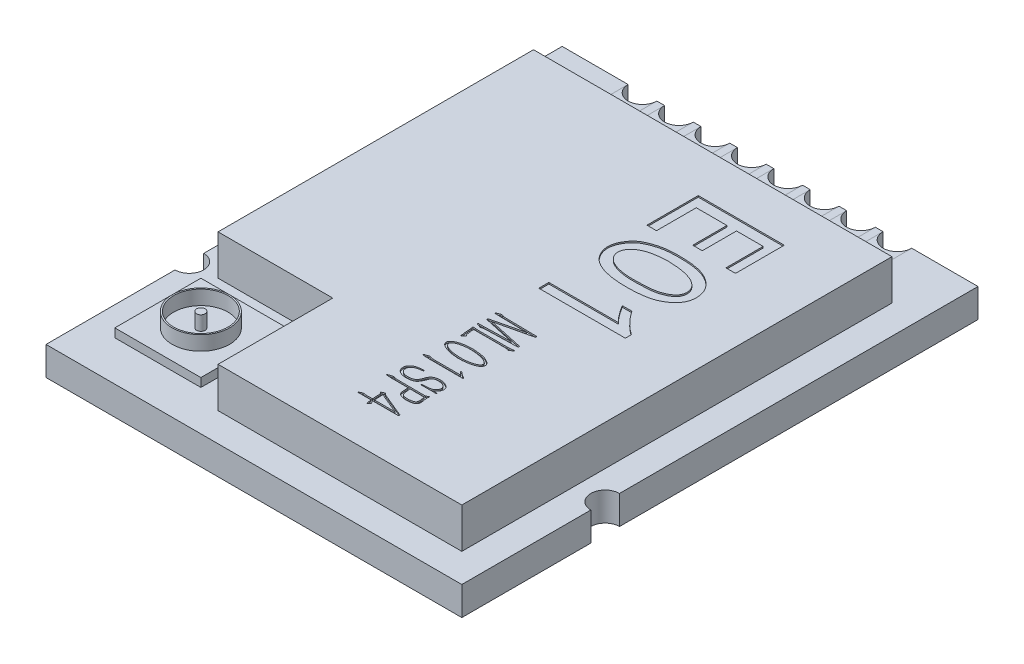
from build123d import *

# Parameters (mm, degrees)
SKETCH_1_W          = 14.5
SKETCH_1_H          = 18
EXTRUDE_1_DEPTH     = 1
EXTRUDE_2_DEPTH     = 1.4
SKETCH_3_W          = 3
SKETCH_3_H          = 3
EXTRUDE_3_DEPTH     = 0.3
SKETCH_4_R          = 1
SKETCH_4_R_2        = 0.95
SKETCH_4_R_3        = 0.15
EXTRUDE_4_DEPTH     = 0.5
CUT_EXTRUDE_2_DEPTH = 1
CUT_EXTRUDE_3_DEPTH = 0.05


with BuildPart() as part:
    # 草图1 → 凸台-拉伸1 (new body)
    with BuildSketch(Plane(origin=(0, 0, 0), x_dir=(1, 0, 0), z_dir=(0, 1, 0))):
        Rectangle(SKETCH_1_W, SKETCH_1_H)
    extrude(amount=EXTRUDE_1_DEPTH)

    # 草图2 → 凸台-拉伸2 (add)
    with BuildSketch(Plane(origin=(0, 1, 0), x_dir=(1, 0, 0), z_dir=(0, 1, 0))):
        Polygon((-6.25, 7), (6.25, 7), (6.25, -8), (-2.25, -8), (-2.25, -4), (-6.25, -4), align=None)
    extrude(amount=EXTRUDE_2_DEPTH)

    # 草图3 → 凸台-拉伸3 (add)
    with BuildSketch(Plane(origin=(0, 1, 0), x_dir=(1, 0, 0), z_dir=(0, 1, 0))):
        with Locations((-4.75, -6.1)):
            Rectangle(SKETCH_3_W, SKETCH_3_H)
    extrude(amount=EXTRUDE_3_DEPTH)

    # 草图4 → 凸台-拉伸4 (add)
    # profile 1 of 2: a face of its own
    with BuildSketch(Plane(origin=(0, 1.3, 0), x_dir=(1, 0, 0), z_dir=(0, 1, 0))):
        with Locations((-4.75, -6.1)):
            Circle(SKETCH_4_R)
        with Locations((-4.75, -6.1)):
            Circle(SKETCH_4_R_2, mode=Mode.SUBTRACT)
    # profile 2 of 2: a face of its own
    with BuildSketch(Plane(origin=(0, 1.3, 0), x_dir=(1, 0, 0), z_dir=(0, 1, 0))):
        with Locations((-4.75, -6.1)):
            Circle(SKETCH_4_R_3)
    extrude(amount=EXTRUDE_4_DEPTH)

    # 草图5 → 切除-拉伸2 (cut)
    with BuildSketch(Plane(origin=(0, 1, 0), x_dir=(1, 0, 0), z_dir=(0, 1, 0))):
        with BuildLine():
            Line((7.25, -4.5), (7.25, -3.5))
            ThreePointArc((7.25, -3.5), (6.75, -4), (7.25, -4.5))
        make_face()
        with BuildLine():
            Line((4.94, 9), (3.94, 9))
            ThreePointArc((3.94, 9), (4.44, 8.5), (4.94, 9))
        make_face()
        with BuildLine():
            Line((3.67, 9), (2.67, 9))
            ThreePointArc((2.67, 9), (3.17, 8.5), (3.67, 9))
        make_face()
        with BuildLine():
            Line((2.4, 9), (1.4, 9))
            ThreePointArc((1.4, 9), (1.9, 8.5), (2.4, 9))
        make_face()
        with BuildLine():
            Line((1.13, 9), (0.13, 9))
            ThreePointArc((0.13, 9), (0.63, 8.5), (1.13, 9))
        make_face()
        with BuildLine():
            Line((-0.14, 9), (-1.14, 9))
            ThreePointArc((-1.14, 9), (-0.64, 8.5), (-0.14, 9))
        make_face()
        with BuildLine():
            Line((-1.41, 9), (-2.41, 9))
            ThreePointArc((-2.41, 9), (-1.91, 8.5), (-1.41, 9))
        make_face()
        with BuildLine():
            Line((-2.68, 9), (-3.68, 9))
            ThreePointArc((-3.68, 9), (-3.18, 8.5), (-2.68, 9))
        make_face()
        with BuildLine():
            Line((-3.95, 9), (-4.95, 9))
            ThreePointArc((-4.95, 9), (-4.45, 8.5), (-3.95, 9))
        make_face()
        with BuildLine():
            ThreePointArc((-7.25, -4.5), (-6.75, -4), (-7.25, -3.5))
            Line((-7.25, -3.5), (-7.25, -4.5))
        make_face()
    extrude(amount=-CUT_EXTRUDE_2_DEPTH, mode=Mode.SUBTRACT)

    # 草图8 → 切除-拉伸3 (cut)
    # profile 1 of 10: a face of its own
    with BuildSketch(Plane(origin=(0, 2.4, 0), x_dir=(1, 0, 0), z_dir=(0, 1, 0))):
        with BuildLine():
            add(Edge.make_bspline(
                [(2.719408538, 3.310669827), (2.757112956, 3.30899923), (2.830652132, 3.305740878), (2.937880304, 3.296326076), (3.039363622, 3.284959248), (3.134787732, 3.270172038), (3.223848684, 3.251925537), (3.306966604, 3.231173751), (3.384141986, 3.207510113), (3.477828631, 3.171141292), (3.586122911, 3.118744345), (3.705443943, 3.043973082), (3.812180351, 2.956173214), (3.890572294, 2.873245263), (3.945721341, 2.801300329), (3.981529897, 2.743822788), (4.012128967, 2.683436641), (4.037067751, 2.619941596), (4.05576072, 2.55326411), (4.069309019, 2.483717775), (4.077893232, 2.411181674), (4.080384581, 2.336640496), (4.076921338, 2.261744939), (4.065256623, 2.188209235), (4.044901876, 2.117216791), (4.01681634, 2.048560008), (3.980745325, 1.98262309), (3.936962545, 1.919076474), (3.884340157, 1.858672881), (3.825013655, 1.800659659), (3.759720202, 1.7464736), (3.689719817, 1.696839296), (3.615734569, 1.651962913), (3.537358563, 1.612442658), (3.455282912, 1.577017324), (3.368776533, 1.547299066), (3.278190921, 1.522710602), (3.150222658, 1.495643957), (2.980477558, 1.471762277), (2.765633169, 1.45526057), (2.53657878, 1.450292763), (2.338468756, 1.456303793), (2.177956904, 1.466984175), (2.061552251, 1.479290488), (1.950978237, 1.495428335), (1.846017583, 1.515515792), (1.746977273, 1.539541148), (1.653245794, 1.566539286), (1.565816955, 1.598632183), (1.483409693, 1.633371257), (1.4072408, 1.672940859), (1.336977023, 1.717467289), (1.272952373, 1.766736893), (1.214253408, 1.820105453), (1.163024904, 1.879338361), (1.116466447, 1.942158397), (1.076845341, 2.010332674), (1.043242871, 2.08202931), (1.016344136, 2.156051862), (0.999189225, 2.231175475), (0.988616116, 2.306003277), (0.988621738, 2.381009901), (0.995256406, 2.456290028), (1.012139766, 2.531053375), (1.036180233, 2.606115118), (1.069434294, 2.679628325), (1.107986901, 2.750507919), (1.149369479, 2.81730027), (1.194774153, 2.877997589), (1.242227617, 2.933900495), (1.293762122, 2.983646591), (1.347429058, 3.028752024), (1.404730553, 3.067854102), (1.485293285, 3.111616959), (1.589236468, 3.158477551), (1.717257973, 3.206987946), (1.848361953, 3.246633105), (1.961025684, 3.272126312), (2.055277665, 3.288933825), (2.132540802, 3.298181365), (2.215711541, 3.306214239), (2.304809247, 3.311069079), (2.399911173, 3.314298365), (2.501085067, 3.315703804), (2.608319157, 3.314199527), (2.681724988, 3.311867166), (2.719408538, 3.310669827)],
                knots=[0, 0, 0, 0, 1.180401138, 2.30226934, 3.366159349, 4.374179899, 5.321522123, 6.208821625, 7.053100499, 7.84448395, 9.350408545, 10.808955378, 12.238514623, 13.661960487, 14.367912389, 15.070965093, 15.776916996, 16.482706337, 17.201128835, 17.939867996, 18.697017101, 19.483367717, 20.27030181, 21.038822776, 21.806566946, 22.575267062, 23.354405183, 24.153091691, 24.984193094, 25.856125472, 26.746110794, 27.635270573, 28.538056939, 29.450049455, 30.378773514, 31.33220089, 32.308462388, 33.313016432, 35.421826328, 37.664457817, 40.049823635, 42.584716208, 43.861430955, 45.080943026, 46.245056048, 47.355843545, 48.422275914, 49.432002526, 50.404991012, 51.333715071, 52.227636976, 53.086548969, 53.932104441, 54.751974227, 55.563289987, 56.377683148, 57.194524263, 58.024962685, 58.852105978, 59.652399965, 60.431390798, 61.210528918, 61.993193633, 62.790499722, 63.602494076, 64.454780901, 65.309621944, 66.125422873, 66.909961955, 67.67860236, 68.416408965, 69.147654381, 69.869232414, 70.58188178, 72.01277284, 73.432133879, 74.861693123, 76.293177485, 77.042771969, 77.855359628, 78.726343967, 79.65608061, 80.645789741, 81.702754436, 82.820688116, 84, 84, 84, 84], degree=3))
        make_face()
        with BuildLine():
            add(Edge.make_bspline(
                [(2.824671696, 2.942248774), (2.785060958, 2.946231789), (2.707026427, 2.954078465), (2.591263725, 2.960496098), (2.478778015, 2.962324949), (2.369523814, 2.96065022), (2.26371489, 2.954191661), (2.161146467, 2.94317228), (2.061890584, 2.927475458), (1.9662103, 2.908264076), (1.875635421, 2.885245704), (1.791394675, 2.857949438), (1.714108131, 2.826874049), (1.643637557, 2.792516517), (1.579973212, 2.754737226), (1.523102952, 2.713032441), (1.472859185, 2.66763776), (1.430025176, 2.618784906), (1.39425718, 2.568599728), (1.366646619, 2.517471832), (1.346649564, 2.466237955), (1.334756835, 2.414347649), (1.330883787, 2.362013348), (1.334616102, 2.309349344), (1.347614668, 2.256761467), (1.3675414, 2.204507777), (1.394982523, 2.154083381), (1.428130136, 2.10639605), (1.467669514, 2.062362629), (1.513487391, 2.02217915), (1.564935698, 1.984989962), (1.622480053, 1.951860127), (1.686077029, 1.922573874), (1.779280979, 1.888266972), (1.903276384, 1.853406332), (2.058517328, 1.823723494), (2.22012879, 1.805266936), (2.386064324, 1.800581507), (2.550915932, 1.803690156), (2.710633305, 1.807282999), (2.862420432, 1.816645131), (3.007355529, 1.825813544), (3.145396532, 1.845618099), (3.276848172, 1.877626817), (3.401129326, 1.924733802), (3.499187217, 1.972847869), (3.570831406, 2.018656106), (3.617876718, 2.0558299), (3.658837704, 2.095404041), (3.691911105, 2.138519568), (3.718724941, 2.183930649), (3.737420998, 2.232543212), (3.749861891, 2.283650402), (3.755656205, 2.33671939), (3.754582412, 2.390541156), (3.745323699, 2.443476963), (3.728713554, 2.494736186), (3.705537938, 2.544522532), (3.673173236, 2.591580284), (3.635019587, 2.638047192), (3.588383972, 2.682027645), (3.53470696, 2.724426487), (3.473751906, 2.764839329), (3.404421573, 2.801092891), (3.327151495, 2.833529951), (3.241961266, 2.862480113), (3.148951582, 2.888510273), (3.048037805, 2.910387878), (2.93914801, 2.928544908), (2.86370027, 2.937576695), (2.824671696, 2.942248774)],
                knots=[0, 0, 0, 0, 1.378109859, 2.714924366, 4.012337428, 5.272264443, 6.496796727, 7.680922092, 8.842201527, 9.974529901, 11.058452956, 12.075719554, 13.037880537, 13.939962823, 14.787411352, 15.59727004, 16.377569041, 17.12669337, 17.842345923, 18.506618572, 19.133259835, 19.740812933, 20.34236731, 20.943921688, 21.560477423, 22.210807048, 22.875079698, 23.542813662, 24.217208585, 24.91837636, 25.648842316, 26.41150434, 27.213304184, 28.069859648, 29.847606029, 31.665245594, 33.536656117, 35.472412322, 37.407122596, 39.244972962, 41.00229723, 42.671808961, 44.270949565, 45.824053721, 47.344966454, 48.864048154, 49.596167141, 50.284752722, 50.936938524, 51.562367323, 52.160406413, 52.75637355, 53.358348383, 53.97690711, 54.599452488, 55.21582581, 55.830005951, 56.460582768, 57.109440959, 57.801650593, 58.538820848, 59.323431323, 60.167789086, 61.066718266, 62.027680548, 63.066306318, 64.179732226, 65.369612762, 66.63931955, 68, 68, 68, 68], degree=3))
        make_face(mode=Mode.SUBTRACT)
    # profile 2 of 10: a face of its own
    with BuildSketch(Plane(origin=(0, 2.4, 0), x_dir=(1, 0, 0), z_dir=(0, 1, 0))):
        Polygon((1.026750968, 3.679090879), (1.026750968, 5.468564564), (4.026750968, 5.468564564), (4.026750968, 3.766810178), (3.693417635, 3.766810178), (3.693417635, 5.065055792), (2.763593074, 5.065055792), (2.763593074, 3.872073336), (2.43025974, 3.872073336), (2.43025974, 5.065055792), (1.360084302, 5.065055792), (1.360084302, 3.679090879), align=None)
    # profile 3 of 10: a face of its own
    with BuildSketch(Plane(origin=(0, 2.4, 0), x_dir=(1, 0, 0), z_dir=(0, 1, 0))):
        with BuildLine():
            add(Edge.make_bspline(
                [(3.465347459, 0.240494388), (3.427027116, 0.280436108), (3.34805627, 0.3627483), (3.238327174, 0.501198781), (3.129495668, 0.653797953), (3.061662199, 0.763158279), (3.026750968, 0.819441757)],
                knots=[0, 0, 0, 0, 0.911926792, 1.879305458, 2.908561558, 4, 4, 4, 4], degree=3))
            Line((3.026750968, 0.819441757), (3.360084302, 0.819441757))
            add(Edge.make_bspline(
                [(3.360084302, 0.819441757), (3.385039465, 0.783419259), (3.434600906, 0.711877878), (3.515212197, 0.610356755), (3.597291756, 0.512205815), (3.684192114, 0.420393112), (3.772950819, 0.33199899), (3.866055239, 0.24995131), (3.961718048, 0.171814879), (4.028436769, 0.124054277), (4.061838688, 0.100143511)],
                knots=[0, 0, 0, 0, 1.040526584, 2.066506081, 3.077559129, 4.07840537, 5.067830316, 6.05167646, 7.024595449, 8, 8, 8, 8], degree=3))
            Line((4.061838688, 0.100143511), (4.061838688, -0.110382805))
            Line((4.061838688, -0.110382805), (1.044294828, -0.110382805))
            Line((1.044294828, -0.110382805), (1.044294828, 0.240494388))
            Line((1.044294828, 0.240494388), (3.465347459, 0.240494388))
        make_face()
    # profile 4 of 10: a face of its own
    with BuildSketch(Plane(origin=(0, 2.4, 0), x_dir=(1, 0, 0), z_dir=(0, 1, 0))):
        with BuildLine():
            Line((2.466519418, -2.202220211), (2.466519418, -2.251762081))
            Line((2.466519418, -2.251762081), (1.454586752, -2.281806829))
            Line((1.454586752, -2.281806829), (1.359658135, -2.284044204))
            add(Edge.make_bspline(
                [(1.359658135, -2.284044204), (1.349108042, -2.284146899), (1.331187078, -2.284321341), (1.307146523, -2.285839017), (1.287035881, -2.288967548), (1.268180301, -2.293906606), (1.249772189, -2.298615015), (1.234595579, -2.305268468), (1.222877671, -2.31036052), (1.214065517, -2.314074358), (1.205337289, -2.31255085), (1.194507846, -2.309540105), (1.178632181, -2.303859804), (1.16628583, -2.299584223), (1.159253277, -2.297148828)],
                knots=[0, 0, 0, 0, 1.832356122, 3.112540229, 4.180385187, 5.360787167, 6.496992333, 7.476352957, 8.222308194, 8.743410119, 9.078547604, 9.729382656, 10.706643147, 12, 12, 12, 12], degree=3))
            Line((1.159253277, -2.297148828), (1.085739533, -2.273176955))
            add(Edge.make_bspline(
                [(1.085739533, -2.273176955), (1.079024831, -2.270530245), (1.067158619, -2.265852983), (1.051822515, -2.259591455), (1.041615829, -2.254874806), (1.034541719, -2.251145683), (1.031335338, -2.246402772), (1.030068796, -2.241052363), (1.033439801, -2.236697015), (1.036641819, -2.235290192), (1.038435037, -2.234502333)],
                knots=[0, 0, 0, 0, 2.256231429, 3.987209208, 5.163648087, 5.79172546, 6.438062171, 6.908826066, 7.388912923, 8, 8, 8, 8], degree=3))
            add(Edge.make_bspline(
                [(1.038435037, -2.234502333), (1.041050128, -2.233154581), (1.047704717, -2.229724973), (1.061749398, -2.22969801), (1.08052995, -2.229725558), (1.094896837, -2.23134925), (1.102999281, -2.232264958)],
                knots=[0, 0, 0, 0, 0.533370556, 1.357261302, 2.50958371, 4, 4, 4, 4], degree=3))
            Line((1.102999281, -2.232264958), (1.238839895, -2.228109833))
            Line((1.238839895, -2.228109833), (2.173103692, -2.202220211))
            Line((2.173103692, -2.202220211), (1.077109659, -1.960583731))
            Line((1.077109659, -1.960583731), (1.079347033, -1.919352109))
            Line((1.079347033, -1.919352109), (2.160318693, -1.658538131))
            Line((2.160318693, -1.658538131), (1.228292271, -1.641278382))
            Line((1.228292271, -1.641278382), (1.094369407, -1.636803633))
            add(Edge.make_bspline(
                [(1.094369407, -1.636803633), (1.084646444, -1.636714294), (1.067266718, -1.636554601), (1.047320778, -1.633795912), (1.034782626, -1.630938374), (1.029369456, -1.628122128), (1.025159074, -1.625431558), (1.025276839, -1.622922625), (1.025330413, -1.621781259)],
                knots=[0, 0, 0, 0, 2.355822379, 4.211015305, 4.907696809, 5.428403058, 5.739968498, 6, 6, 6, 6], degree=3))
            add(Edge.make_bspline(
                [(1.025330413, -1.621781259), (1.025569942, -1.620271696), (1.026056478, -1.617205442), (1.029000229, -1.611541314), (1.038599351, -1.606597581), (1.049845091, -1.603051995), (1.060557841, -1.599574623), (1.067435575, -1.597802717), (1.071829603, -1.596251761), (1.074122694, -1.595980356), (1.074872284, -1.595891636)],
                knots=[0, 0, 0, 0, 0.619468981, 1.258277768, 2.506248205, 4.805438833, 6.119174814, 7.064109572, 7.694066076, 8, 8, 8, 8], degree=3))
            Line((1.074872284, -1.595891636), (1.172038276, -1.556897389))
            add(Edge.make_bspline(
                [(1.172038276, -1.556897389), (1.176916543, -1.555798251), (1.186501097, -1.553638722), (1.201610895, -1.554710783), (1.217771366, -1.55803046), (1.234275225, -1.564547393), (1.249831612, -1.569991618), (1.260821841, -1.574973222), (1.269425967, -1.577414036), (1.278041041, -1.57840266), (1.289321065, -1.579757119), (1.302540829, -1.580917702), (1.315753566, -1.581849903), (1.327190466, -1.582244028), (1.335685778, -1.583329636), (1.341647911, -1.584001796), (1.346759298, -1.584488569), (1.352838352, -1.584744452), (1.361574083, -1.585071871), (1.372974716, -1.585391842), (1.38704464, -1.585591658), (1.403652064, -1.586478768), (1.422948664, -1.586529783), (1.436688795, -1.587006657), (1.444039128, -1.587261762)],
                knots=[0, 0, 0, 0, 1.188152674, 2.33441766, 3.582120705, 5.119322683, 6.560869865, 7.520140262, 7.995537568, 8.690117353, 9.586575242, 10.710879641, 11.85855611, 12.750669267, 13.441978224, 13.902850862, 14.183926962, 14.668097421, 15.355649237, 16.272110243, 17.392086493, 18.716331466, 20.243389576, 22, 22, 22, 22], degree=3))
            Line((1.444039128, -1.587261762), (2.466519418, -1.602284136))
            Line((2.466519418, -1.602284136), (2.466519418, -1.654063381))
            Line((2.466519418, -1.654063381), (1.245552019, -1.936611858))
            Line((1.245552019, -1.936611858), (2.466519418, -2.202220211))
        make_face()
    # profile 5 of 10: a face of its own
    with BuildSketch(Plane(origin=(0, 2.4, 0), x_dir=(1, 0, 0), z_dir=(0, 1, 0))):
        with BuildLine():
            Line((2.494646415, -2.416368943), (2.511906164, -2.431391317))
            Line((2.511906164, -2.431391317), (2.393325299, -2.526319934))
            add(Edge.make_bspline(
                [(2.393325299, -2.526319934), (2.388213961, -2.523546809), (2.378161347, -2.518092826), (2.362372636, -2.50960826), (2.342969366, -2.502442831), (2.318359095, -2.49806377), (2.289131564, -2.49430057), (2.268154565, -2.494128143), (2.25716506, -2.494037811)],
                knots=[0, 0, 0, 0, 0.736990612, 1.449460352, 2.269560721, 3.34453594, 4.608846078, 6, 6, 6, 6], degree=3))
            Line((2.25716506, -2.494037811), (1.157015902, -2.494037811))
            add(Edge.make_bspline(
                [(1.157015902, -2.494037811), (1.156921078, -2.502882485), (1.156747393, -2.519083047), (1.157800335, -2.540909127), (1.157689834, -2.557983933), (1.158857521, -2.571951875), (1.160809202, -2.586628061), (1.163431695, -2.605783191), (1.166440629, -2.63140554), (1.170722634, -2.661223236), (1.175278926, -2.691361941), (1.179273978, -2.717705286), (1.182960435, -2.738348092), (1.186140123, -2.757723959), (1.192933643, -2.776642057), (1.204981918, -2.793235112), (1.217320705, -2.803943932), (1.22045891, -2.812281879), (1.221580146, -2.81526091)],
                knots=[0, 0, 0, 0, 1.271616382, 2.329187238, 3.141327763, 3.725325049, 4.342921376, 5.270297167, 6.505489821, 8.052499159, 9.601706978, 10.888826415, 11.883727312, 12.616882248, 13.712498293, 14.73302115, 15.547326424, 16, 16, 16, 16], degree=3))
            add(Edge.make_bspline(
                [(1.221580146, -2.81526091), (1.220517542, -2.816648067), (1.217380706, -2.820742992), (1.210739658, -2.829099464), (1.199132241, -2.842129941), (1.184022279, -2.858865386), (1.167939768, -2.875019912), (1.156261466, -2.888834662), (1.147024613, -2.897766313), (1.138316008, -2.902159643), (1.130820607, -2.903087049), (1.126543266, -2.903585966), (1.12473378, -2.903797027)],
                knots=[0, 0, 0, 0, 0.390098921, 1.151582498, 2.382199169, 4.28453323, 6.185677403, 7.465641793, 8.324860778, 9.037610041, 9.592870643, 10, 10, 10, 10], degree=3))
            add(Edge.make_bspline(
                [(1.12473378, -2.903797027), (1.122664617, -2.902912647), (1.118421579, -2.901099132), (1.11470732, -2.894575958), (1.112334354, -2.886512253), (1.112706372, -2.872314355), (1.113302097, -2.851934027), (1.109217429, -2.825445119), (1.105305861, -2.797129778), (1.101724658, -2.774684758), (1.099259283, -2.757648686), (1.098135768, -2.745045492), (1.096411389, -2.729193551), (1.094966817, -2.709991894), (1.092990039, -2.687623597), (1.090770027, -2.661945476), (1.088135244, -2.632981625), (1.086565173, -2.61251437), (1.085739533, -2.601751427)],
                knots=[0, 0, 0, 0, 0.341412098, 0.700101798, 1.114612728, 1.645445725, 2.888978516, 4.291569828, 5.799296003, 7.342256916, 7.827641959, 8.477671228, 9.310827887, 10.309102401, 11.473988745, 12.805491799, 14.320130847, 16, 16, 16, 16], degree=3))
            Line((1.085739533, -2.601751427), (1.077109659, -2.51129756))
            Line((1.077109659, -2.51129756), (1.072954534, -2.461436064))
            add(Edge.make_bspline(
                [(1.072954534, -2.461436064), (1.071238564, -2.45624045), (1.068490048, -2.447918493), (1.070375818, -2.4356827), (1.077468852, -2.430345491), (1.085360387, -2.426258148), (1.097607259, -2.42598604), (1.114675309, -2.428585512), (1.138120212, -2.431455467), (1.155840531, -2.432854538), (1.165645776, -2.433628691)],
                knots=[0, 0, 0, 0, 1.060740538, 1.699016902, 2.227258179, 2.709177445, 3.416371528, 4.542100472, 6.086628716, 8, 8, 8, 8], degree=3))
            Line((1.165645776, -2.433628691), (1.292856516, -2.437783816))
            Line((1.292856516, -2.437783816), (2.263877185, -2.437783816))
            add(Edge.make_bspline(
                [(2.263877185, -2.437783816), (2.275916396, -2.437817837), (2.297544952, -2.437878957), (2.326206013, -2.437523437), (2.347510221, -2.437153036), (2.366611411, -2.436967184), (2.386804283, -2.434897119), (2.412003465, -2.434082007), (2.441175732, -2.429258994), (2.461672489, -2.423617558), (2.472911917, -2.420524067)],
                knots=[0, 0, 0, 0, 1.372094769, 2.464981067, 3.266473535, 3.800878489, 4.640903104, 5.577839436, 6.671804463, 8, 8, 8, 8], degree=3))
            Line((2.472911917, -2.420524067), (2.494646415, -2.416368943))
        make_face()
    # profile 6 of 10: a face of its own
    with BuildSketch(Plane(origin=(0, 2.4, 0), x_dir=(1, 0, 0), z_dir=(0, 1, 0))):
        with BuildLine():
            add(Edge.make_bspline(
                [(1.780604225, -3.095572011), (1.801281505, -3.096613608), (1.843645378, -3.098747646), (1.908579198, -3.104548982), (1.976320184, -3.113106221), (2.045889041, -3.12302906), (2.114612628, -3.136760754), (2.179970688, -3.154330735), (2.240391254, -3.17677413), (2.286811567, -3.199129303), (2.320794326, -3.218108537), (2.343575046, -3.231758449), (2.363654077, -3.245344657), (2.381676678, -3.257824626), (2.39679641, -3.270509397), (2.409684225, -3.282510834), (2.419983301, -3.294293488), (2.430082163, -3.309092868), (2.439012116, -3.327010921), (2.447042336, -3.347707398), (2.451535603, -3.367693853), (2.451509591, -3.380764874), (2.451497044, -3.387069987)],
                knots=[0, 0, 0, 0, 1.583397956, 3.244085741, 4.984565514, 6.805406931, 8.617658131, 10.341500556, 11.976215038, 13.539799827, 14.276665524, 14.9530614, 15.570057346, 16.130843377, 16.628518298, 17.078105215, 17.476728523, 17.822547002, 18.445753756, 19.002737804, 19.518947217, 20, 20, 20, 20], degree=3))
            add(Edge.make_bspline(
                [(2.451497044, -3.387069987), (2.450442623, -3.393100079), (2.448215522, -3.405836574), (2.439934526, -3.424666041), (2.428922539, -3.444652076), (2.414646433, -3.465910506), (2.395467429, -3.487159711), (2.369951495, -3.506779158), (2.339100392, -3.525465939), (2.289881291, -3.548070981), (2.223206793, -3.572708409), (2.153356791, -3.592449286), (2.094970054, -3.605182043), (2.048396004, -3.613538596), (1.998978492, -3.620019398), (1.929614663, -3.62785205), (1.8405674, -3.633368189), (1.768891304, -3.634521256), (1.732980104, -3.635098966)],
                knots=[0, 0, 0, 0, 0.363668269, 0.768123999, 1.21713139, 1.72437065, 2.290761039, 2.914542043, 3.635475112, 4.436472082, 6.138405562, 7.867171485, 8.757724193, 9.699398782, 10.686337048, 11.727666409, 13.859472931, 16, 16, 16, 16], degree=3))
            add(Edge.make_bspline(
                [(1.732980104, -3.635098966), (1.704201393, -3.633138768), (1.645055137, -3.629110152), (1.554451545, -3.619601277), (1.460301033, -3.603593103), (1.380702491, -3.584507672), (1.317700088, -3.564618169), (1.272007641, -3.548483484), (1.229041033, -3.530132364), (1.188783412, -3.511113239), (1.152998469, -3.490909275), (1.123342861, -3.469539408), (1.099900976, -3.447782727), (1.083435615, -3.425017628), (1.072075363, -3.402761652), (1.065023043, -3.381392686), (1.060965977, -3.361108422), (1.061723672, -3.347982356), (1.062087285, -3.341683241)],
                knots=[0, 0, 0, 0, 1.760159261, 3.617494468, 5.556320195, 7.584109925, 8.606055017, 9.586975504, 10.539676133, 11.455643988, 12.303159751, 13.043080423, 13.682227646, 14.245293979, 14.748294383, 15.20059029, 15.616368411, 16, 16, 16, 16], degree=3))
            add(Edge.make_bspline(
                [(1.062087285, -3.341683241), (1.062933223, -3.335665134), (1.064715549, -3.322985449), (1.072215785, -3.303872713), (1.083771632, -3.283969334), (1.099004606, -3.262721084), (1.119932461, -3.241325377), (1.147001056, -3.220722091), (1.180358223, -3.200965995), (1.219364269, -3.182181423), (1.262822256, -3.164579366), (1.309639161, -3.149012463), (1.359023094, -3.135240346), (1.410455755, -3.123586459), (1.462566879, -3.114382054), (1.51364485, -3.106284414), (1.563408934, -3.10173471), (1.611388007, -3.098916048), (1.65732848, -3.097427129), (1.700802094, -3.096516441), (1.741608135, -3.095838456), (1.767925553, -3.09565864), (1.780604225, -3.095572011)],
                knots=[0, 0, 0, 0, 0.451210355, 0.950665392, 1.515389005, 2.162698409, 2.891911649, 3.734370314, 4.687943, 5.773448671, 6.954736073, 8.176267595, 9.444496654, 10.770279691, 12.100492322, 13.383787146, 14.618968347, 15.818804081, 16.961679615, 18.040674402, 19.056075852, 20, 20, 20, 20], degree=3))
        make_face()
        with BuildLine():
            add(Edge.make_bspline(
                [(1.776129475, -3.151826006), (1.76579541, -3.151598542), (1.743850818, -3.151115517), (1.708899508, -3.150656188), (1.670008067, -3.151512997), (1.612618103, -3.152978294), (1.537614026, -3.158346092), (1.44758028, -3.172120691), (1.360314671, -3.19162749), (1.292050651, -3.213621948), (1.243428837, -3.23387097), (1.213019217, -3.248869805), (1.188685293, -3.265187093), (1.170071829, -3.282194132), (1.156890224, -3.299421332), (1.147468899, -3.315515959), (1.140999941, -3.330768664), (1.140156264, -3.340990635), (1.139756153, -3.345838365)],
                knots=[0, 0, 0, 0, 0.705765407, 1.498706842, 2.38630117, 3.36150308, 5.418560001, 7.515224295, 9.574595116, 11.518435722, 12.401996664, 13.169780445, 13.8295476, 14.395736007, 14.883174148, 15.303643723, 15.669755697, 16, 16, 16, 16], degree=3))
            add(Edge.make_bspline(
                [(1.139756153, -3.345838365), (1.139811121, -3.350327528), (1.139929191, -3.35997019), (1.143630926, -3.375124768), (1.151100513, -3.391163881), (1.161261632, -3.408789206), (1.176563986, -3.426901486), (1.197993155, -3.444325698), (1.224690526, -3.462267217), (1.256746086, -3.479658866), (1.292459933, -3.495718886), (1.330056606, -3.51061989), (1.369042354, -3.52331781), (1.423302865, -3.537929556), (1.49410212, -3.551393691), (1.580238285, -3.564578875), (1.665298168, -3.572731826), (1.734633537, -3.577135458), (1.789557028, -3.57737806), (1.833245905, -3.576722003), (1.880133636, -3.575127456), (1.912505609, -3.573363683), (1.929229837, -3.572452471)],
                knots=[0, 0, 0, 0, 0.308069677, 0.661729547, 1.061957328, 1.521849412, 2.057500112, 2.681345295, 3.414929569, 4.267474261, 5.185505899, 6.106602273, 7.047276241, 8.003458423, 9.969115299, 11.998978725, 13.994341942, 15.843514921, 16.774033408, 17.770571002, 18.848217284, 20, 20, 20, 20], degree=3))
            add(Edge.make_bspline(
                [(1.929229837, -3.572452471), (1.944897034, -3.57091083), (1.975306838, -3.567918527), (2.019257051, -3.562660318), (2.060043696, -3.556126225), (2.110306657, -3.54695898), (2.1704862, -3.531901238), (2.228181811, -3.512196733), (2.271264617, -3.493929435), (2.298807669, -3.47885578), (2.322101868, -3.463411968), (2.33988829, -3.446281964), (2.353746324, -3.429601459), (2.364104343, -3.413903356), (2.371417501, -3.399240982), (2.373069445, -3.389367473), (2.373828175, -3.384832612)],
                knots=[0, 0, 0, 0, 1.302778717, 2.528674717, 3.66218977, 4.720482596, 6.756195314, 8.788793582, 9.760107648, 10.624185129, 11.384772018, 12.064570095, 12.65948223, 13.175463919, 13.621293999, 14, 14, 14, 14], degree=3))
            add(Edge.make_bspline(
                [(2.373828175, -3.384832612), (2.373470335, -3.379902418), (2.372718384, -3.369542325), (2.367855575, -3.353738484), (2.360383953, -3.336992726), (2.349566233, -3.318762061), (2.33305777, -3.299273919), (2.308166637, -3.279927634), (2.275449852, -3.259820766), (2.235101942, -3.238887206), (2.18758977, -3.218861669), (2.13315489, -3.201885374), (2.072777553, -3.187076163), (2.008005445, -3.176494689), (1.943260068, -3.167576977), (1.882437964, -3.160092783), (1.827330476, -3.154865565), (1.792543484, -3.152800428), (1.776129475, -3.151826006)],
                knots=[0, 0, 0, 0, 0.347417908, 0.730048635, 1.15696885, 1.638557244, 2.219229089, 2.945095593, 3.849219324, 4.923856479, 6.145410379, 7.477521748, 8.938023946, 10.522977204, 12.099817758, 13.544270741, 14.841280599, 16, 16, 16, 16], degree=3))
        make_face(mode=Mode.SUBTRACT)
    # profile 7 of 10: a face of its own
    with BuildSketch(Plane(origin=(0, 2.4, 0), x_dir=(1, 0, 0), z_dir=(0, 1, 0))):
        with BuildLine():
            Line((2.453734419, -4.136270924), (2.453734419, -4.159923172))
            Line((2.453734419, -4.159923172), (1.307878889, -4.157685798))
            add(Edge.make_bspline(
                [(1.307878889, -4.157685798), (1.297545052, -4.157430916), (1.277731068, -4.156942208), (1.24938239, -4.156902586), (1.223715312, -4.155970134), (1.200692997, -4.155896296), (1.180345801, -4.155201729), (1.162668615, -4.154403973), (1.147630831, -4.154316256), (1.124077563, -4.152959437), (1.091819414, -4.150444398), (1.058237422, -4.147552954), (1.034789436, -4.143090247), (1.023649376, -4.140443059), (1.015370924, -4.135772426), (1.016316804, -4.13157947), (1.016700539, -4.129878425)],
                knots=[0, 0, 0, 0, 1.451232704, 2.782577199, 3.979589708, 5.056668335, 6.014446553, 6.83767935, 7.540863648, 8.124991547, 10.149851631, 12.075891579, 12.882652565, 13.445716813, 13.775132212, 14, 14, 14, 14], degree=3))
            add(Edge.make_bspline(
                [(1.016700539, -4.129878425), (1.017021865, -4.129453912), (1.018397223, -4.127636895), (1.021308349, -4.123303812), (1.029111794, -4.118155216), (1.036112533, -4.115901482), (1.040352787, -4.114536426)],
                knots=[0, 0, 0, 0, 0.221265066, 0.947068446, 2.150880552, 4, 4, 4, 4], degree=3))
            Line((1.040352787, -4.114536426), (1.068479784, -4.103988802))
            Line((1.068479784, -4.103988802), (1.146148653, -4.080016929))
            add(Edge.make_bspline(
                [(1.146148653, -4.080016929), (1.153465168, -4.077157203), (1.166210161, -4.072175708), (1.182849241, -4.066869646), (1.193680247, -4.063521392), (1.202233458, -4.062527649), (1.210530043, -4.066936852), (1.22291803, -4.070786496), (1.238935677, -4.076273899), (1.257783016, -4.081578525), (1.278165458, -4.086214083), (1.300180232, -4.090452236), (1.325003332, -4.09264006), (1.348655609, -4.094541578), (1.371486049, -4.09470223), (1.393430711, -4.095072136), (1.419427055, -4.095449321), (1.438179232, -4.095390397), (1.448194253, -4.095358928)],
                knots=[0, 0, 0, 0, 1.221104959, 2.127101808, 2.709551176, 2.991566253, 3.431589559, 4.117801824, 5.023798672, 6.056541768, 7.16126461, 8.272176424, 9.537727718, 11.031480746, 11.959016347, 13.085251807, 14.443313417, 16, 16, 16, 16], degree=3))
            Line((1.448194253, -4.095358928), (2.293921932, -4.097276678))
            Line((2.293921932, -4.097276678), (2.19675594, -3.985088312))
            Line((2.19675594, -3.985088312), (2.233512812, -3.976458438))
            add(Edge.make_bspline(
                [(2.233512812, -3.976458438), (2.242938549, -3.985574244), (2.260607483, -4.0026622), (2.286007942, -4.025550592), (2.308224629, -4.044257518), (2.333672194, -4.064303124), (2.366165017, -4.085689146), (2.392433157, -4.101926784), (2.406110298, -4.110381302)],
                knots=[0, 0, 0, 0, 1.077111798, 2.019090495, 2.807993284, 3.46276432, 4.678927073, 6, 6, 6, 6], degree=3))
            Line((2.406110298, -4.110381302), (2.453734419, -4.136270924))
        make_face()
    # profile 8 of 10: a face of its own
    with BuildSketch(Plane(origin=(0, 2.4, 0), x_dir=(1, 0, 0), z_dir=(0, 1, 0))):
        with BuildLine():
            Line((2.311181681, -5.038572224), (2.44286717, -5.060306722))
            Line((2.44286717, -5.060306722), (2.440629795, -5.081721596))
            Line((2.440629795, -5.081721596), (1.901422465, -5.081721596))
            Line((1.901422465, -5.081721596), (1.89918509, -5.055831973))
            Line((1.89918509, -5.055831973), (2.127716946, -5.040809599))
            add(Edge.make_bspline(
                [(2.127716946, -5.040809599), (2.140423108, -5.038826667), (2.163910847, -5.035161154), (2.195745475, -5.028052096), (2.221679924, -5.021251418), (2.248249129, -5.011546857), (2.276273587, -4.996020261), (2.30662338, -4.973604448), (2.3335897, -4.946243667), (2.355106325, -4.914227834), (2.371435298, -4.879484227), (2.374545361, -4.854523308), (2.37606555, -4.842322491)],
                knots=[0, 0, 0, 0, 1.116104123, 2.063153488, 2.830567178, 3.442211361, 4.514053799, 5.598078685, 6.709997522, 7.828513521, 8.938584293, 10, 10, 10, 10], degree=3))
            add(Edge.make_bspline(
                [(2.37606555, -4.842322491), (2.375753477, -4.835052835), (2.375112755, -4.820127381), (2.370712368, -4.801386687), (2.364853386, -4.785429205), (2.357437873, -4.772257858), (2.347152079, -4.75799207), (2.33480822, -4.742806634), (2.320378245, -4.727605935), (2.304005024, -4.713698453), (2.285695684, -4.701867588), (2.259513354, -4.689116783), (2.226159107, -4.676333678), (2.191489442, -4.66835292), (2.162585981, -4.664803826), (2.138225256, -4.661904901), (2.11077387, -4.661146339), (2.081174695, -4.659799594), (2.050631357, -4.660403824), (2.020792018, -4.664927875), (1.992390861, -4.672814375), (1.974742586, -4.680790277), (1.965986709, -4.684747379)],
                knots=[0, 0, 0, 0, 0.864256277, 1.774419376, 2.275860491, 2.882827095, 3.565066841, 4.366831751, 5.209533517, 6.055090295, 6.916460278, 7.795097233, 9.516017626, 11.154877947, 12.01175965, 12.980414803, 14.071680427, 15.276446731, 16.506551529, 17.698648785, 18.85822568, 20, 20, 20, 20], degree=3))
            add(Edge.make_bspline(
                [(1.965986709, -4.684747379), (1.957865843, -4.689224454), (1.942028912, -4.697955435), (1.920966008, -4.714299119), (1.903755117, -4.733504459), (1.886678562, -4.760651697), (1.870801354, -4.792780367), (1.860594231, -4.818189668), (1.856035719, -4.829537492)],
                knots=[0, 0, 0, 0, 0.892386811, 1.740290775, 2.554224131, 3.362639231, 4.822151631, 6, 6, 6, 6], degree=3))
            Line((1.856035719, -4.829537492), (1.825671346, -4.904968985))
            add(Edge.make_bspline(
                [(1.825671346, -4.904968985), (1.821379417, -4.914275324), (1.813115582, -4.932194088), (1.799969031, -4.957449064), (1.786968668, -4.980313554), (1.769361158, -5.006623345), (1.74623118, -5.035601144), (1.714351545, -5.064286518), (1.678119736, -5.087429123), (1.636178103, -5.102645731), (1.59026313, -5.113477289), (1.540674281, -5.121468662), (1.486424923, -5.126376052), (1.428423331, -5.129137921), (1.368478096, -5.127534234), (1.329336282, -5.119960208), (1.310116264, -5.116241093)],
                knots=[0, 0, 0, 0, 0.703174141, 1.35391705, 1.953350921, 2.506934241, 3.52548439, 4.488463203, 5.437829236, 6.45616944, 7.532539377, 8.673212565, 9.89978345, 11.268238982, 12.658608556, 14, 14, 14, 14], degree=3))
            add(Edge.make_bspline(
                [(1.310116264, -5.116241093), (1.290840559, -5.111537527), (1.253504688, -5.102427007), (1.210627621, -5.082686546), (1.180266418, -5.065442563), (1.160740867, -5.052566528), (1.143644413, -5.040147582), (1.123845139, -5.023328669), (1.103219388, -4.997338733), (1.086313957, -4.96740662), (1.075975904, -4.939661266), (1.070155517, -4.916527446), (1.067105592, -4.89173203), (1.066535432, -4.874718515), (1.066242409, -4.865974739)],
                knots=[0, 0, 0, 0, 1.868003723, 3.618209874, 4.428549287, 5.161723048, 5.823107882, 6.421629236, 7.606883146, 8.929691001, 9.648462166, 10.394407926, 11.174836076, 12, 12, 12, 12], degree=3))
            add(Edge.make_bspline(
                [(1.066242409, -4.865974739), (1.066308519, -4.856157817), (1.066437915, -4.836943069), (1.07091788, -4.808910934), (1.079376473, -4.782532616), (1.091649761, -4.757888541), (1.107236321, -4.734779288), (1.1253478, -4.713022236), (1.146505288, -4.693188732), (1.169765474, -4.674393423), (1.196192333, -4.65809687), (1.224535482, -4.642704043), (1.255861607, -4.630591674), (1.299614887, -4.616243393), (1.355251265, -4.603270392), (1.400392105, -4.600024349), (1.42230463, -4.598448636)],
                knots=[0, 0, 0, 0, 0.833854097, 1.6321101, 2.402748685, 3.180594609, 3.964483268, 4.7682714, 5.582003262, 6.426613426, 7.306205384, 8.217956254, 9.165025086, 10.156210307, 12.134125674, 14, 14, 14, 14], degree=3))
            Line((1.42230463, -4.598448636), (1.53673037, -4.589818762))
            Line((1.53673037, -4.589818762), (1.53673037, -4.620183134))
            add(Edge.make_bspline(
                [(1.53673037, -4.620183134), (1.523190426, -4.621929781), (1.497141489, -4.625290083), (1.459565588, -4.631194485), (1.424927635, -4.636885248), (1.383533168, -4.644161106), (1.336767409, -4.655534435), (1.285969315, -4.67349018), (1.241249776, -4.696844256), (1.210068389, -4.722175314), (1.188349177, -4.743704753), (1.175624927, -4.760588253), (1.164925613, -4.777270042), (1.155661161, -4.79989587), (1.148282483, -4.828111903), (1.148352177, -4.850799823), (1.148386028, -4.861819614)],
                knots=[0, 0, 0, 0, 1.134776714, 2.183149769, 3.161555936, 4.052699768, 5.676561861, 7.155795671, 8.522790098, 9.84643787, 10.478963242, 11.059977006, 11.600716688, 12.120527015, 13.087117758, 14, 14, 14, 14], degree=3))
            add(Edge.make_bspline(
                [(1.148386028, -4.861819614), (1.148755859, -4.871435278), (1.149473067, -4.890082768), (1.154929278, -4.916723771), (1.163921419, -4.941003321), (1.176949364, -4.962577432), (1.193161697, -4.981814557), (1.211948972, -4.99915733), (1.233138212, -5.015037647), (1.256917488, -5.028287723), (1.281503325, -5.039969517), (1.305926807, -5.049622593), (1.329836375, -5.056615757), (1.35329461, -5.061955137), (1.377684651, -5.065220836), (1.403648425, -5.066387832), (1.43178061, -5.067752955), (1.451176468, -5.067060568), (1.461298876, -5.066699222)],
                knots=[0, 0, 0, 0, 1.095903634, 2.1252668, 3.086556001, 4.034624865, 4.983549703, 5.946373285, 6.945093537, 7.995466281, 9.044362349, 10.048389491, 10.98636182, 11.882482185, 12.789734906, 13.787863761, 14.845519177, 16, 16, 16, 16], degree=3))
            add(Edge.make_bspline(
                [(1.461298876, -5.066699222), (1.477100734, -5.06559535), (1.506593703, -5.063535056), (1.547102277, -5.056586404), (1.581306214, -5.048862902), (1.609242672, -5.037688907), (1.632560086, -5.024410596), (1.653043196, -5.009865714), (1.67192516, -4.99439991), (1.68808312, -4.976235206), (1.70288465, -4.956123824), (1.716945755, -4.933726064), (1.73016824, -4.908648054), (1.737702532, -4.890650604), (1.741609978, -4.881316737)],
                knots=[0, 0, 0, 0, 1.577820015, 2.944881455, 4.093665166, 5.065907885, 5.931360948, 6.762240305, 7.568595587, 8.35798795, 9.177867226, 10.055934531, 10.991765707, 12, 12, 12, 12], degree=3))
            Line((1.741609978, -4.881316737), (1.776129475, -4.78830587))
            add(Edge.make_bspline(
                [(1.776129475, -4.78830587), (1.782423049, -4.773706858), (1.794821339, -4.744946919), (1.820465232, -4.705977049), (1.851027045, -4.671876445), (1.888319017, -4.644472284), (1.931608424, -4.623177841), (1.972439659, -4.61102307), (2.008794037, -4.603144772), (2.039974548, -4.600115449), (2.074202522, -4.597967882), (2.097987547, -4.598283283), (2.110457197, -4.598448636)],
                knots=[0, 0, 0, 0, 1.148654714, 2.26284086, 3.359793028, 4.445414205, 5.590206664, 6.8339345, 7.518937951, 8.279293139, 9.097894003, 10, 10, 10, 10], degree=3))
            add(Edge.make_bspline(
                [(2.110457197, -4.598448636), (2.121222489, -4.598536541), (2.142032737, -4.598706468), (2.172127508, -4.600987243), (2.199924677, -4.604646905), (2.233680871, -4.612111888), (2.273559649, -4.623979633), (2.317952355, -4.643115551), (2.357925814, -4.664593832), (2.391163138, -4.689910061), (2.41738047, -4.718712624), (2.435267433, -4.745166952), (2.445982947, -4.768965585), (2.451891178, -4.789257802), (2.45478183, -4.811875108), (2.455355117, -4.827719923), (2.455652169, -4.835929991)],
                knots=[0, 0, 0, 0, 0.971438024, 1.877874368, 2.722414438, 3.49949346, 4.996244094, 6.46980092, 7.855884959, 9.08304859, 10.219605673, 11.358479236, 11.948218795, 12.569048444, 13.258545469, 14, 14, 14, 14], degree=3))
            add(Edge.make_bspline(
                [(2.455652169, -4.835929991), (2.454605372, -4.845133339), (2.452523435, -4.863437545), (2.445245011, -4.890283234), (2.434805382, -4.916262269), (2.420592418, -4.940490712), (2.404954991, -4.96282813), (2.388211344, -4.98257254), (2.370815236, -4.999314324), (2.358169565, -5.008344066), (2.352093677, -5.012682601)],
                knots=[0, 0, 0, 0, 1.050083224, 2.088472429, 3.146187677, 4.218663254, 5.26881611, 6.238152715, 7.153482214, 8, 8, 8, 8], degree=3))
            Line((2.352093677, -5.012682601), (2.311181681, -5.038572224))
        make_face()
    # profile 9 of 10: a face of its own
    with BuildSketch(Plane(origin=(0, 2.4, 0), x_dir=(1, 0, 0), z_dir=(0, 1, 0))):
        with BuildLine():
            add(Edge.make_bspline(
                [(2.414740172, -5.412853068), (2.41753474, -5.429383129), (2.422896701, -5.461099496), (2.432025549, -5.507031217), (2.439854833, -5.551448596), (2.441856475, -5.581050968), (2.44286717, -5.595998178)],
                knots=[0, 0, 0, 0, 1.084764189, 2.081346211, 3.031208728, 4, 4, 4, 4], degree=3))
            add(Edge.make_bspline(
                [(2.44286717, -5.595998178), (2.443053856, -5.604528322), (2.443409353, -5.620771794), (2.441015775, -5.643872871), (2.437259139, -5.66453439), (2.430275558, -5.682747076), (2.420580158, -5.699199557), (2.408183064, -5.715157719), (2.392371229, -5.730650807), (2.373526888, -5.74619644), (2.350738851, -5.760263545), (2.323754635, -5.772143883), (2.292570391, -5.781492961), (2.246450316, -5.791258232), (2.187851347, -5.799102672), (2.130322849, -5.802210486), (2.087202151, -5.802560905), (2.057813467, -5.800587141), (2.03053002, -5.798863482), (2.013274174, -5.795906447), (2.004980956, -5.794485286)],
                knots=[0, 0, 0, 0, 0.833814702, 1.5877862, 2.26846007, 2.882072065, 3.484517613, 4.130808055, 4.853063192, 5.645804051, 6.516394549, 7.463540705, 8.521789618, 9.695256066, 12.072839066, 14.29639108, 15.328236773, 16.288538762, 17.177465991, 18, 18, 18, 18], degree=3))
            add(Edge.make_bspline(
                [(2.004980956, -5.794485286), (1.995251157, -5.792721462), (1.9762852, -5.789283301), (1.949170094, -5.781702145), (1.923802131, -5.773518041), (1.900503826, -5.764111342), (1.879581226, -5.75303592), (1.860802036, -5.741394714), (1.84424025, -5.728841172), (1.825795241, -5.711277103), (1.807620731, -5.687041415), (1.793352682, -5.65536776), (1.786623106, -5.623240457), (1.785367845, -5.602093952), (1.78475935, -5.591843053)],
                knots=[0, 0, 0, 0, 1.080013297, 2.105232101, 3.073537945, 3.992426475, 4.84648014, 5.657300293, 6.404794203, 7.112991927, 8.435604569, 9.686314417, 10.878426723, 12, 12, 12, 12], degree=3))
            Line((1.78475935, -5.591843053), (1.780604225, -5.507781685))
            Line((1.780604225, -5.507781685), (1.765262226, -5.39559332))
            Line((1.765262226, -5.39559332), (1.187060649, -5.393355945))
            add(Edge.make_bspline(
                [(1.187060649, -5.393355945), (1.174273326, -5.393103089), (1.151250466, -5.392647838), (1.120581093, -5.391174959), (1.097449858, -5.390327315), (1.075999527, -5.389173535), (1.052432073, -5.386080033), (1.029880964, -5.383509712), (1.011957388, -5.381276354), (1.003720673, -5.378190796), (0.996551705, -5.375964771), (0.997029593, -5.372779887), (0.997203415, -5.371621447)],
                knots=[0, 0, 0, 0, 1.968092258, 3.543439984, 4.724950778, 5.529841745, 6.849767621, 8.368910709, 9.067026456, 9.549236871, 9.83604354, 10, 10, 10, 10], degree=3))
            add(Edge.make_bspline(
                [(0.997203415, -5.371621447), (0.997522349, -5.371195126), (0.998837663, -5.369436939), (1.002023352, -5.365308315), (1.009866986, -5.360299871), (1.016940796, -5.357984869), (1.021175288, -5.356599073)],
                knots=[0, 0, 0, 0, 0.221181402, 0.912174193, 2.151579728, 4, 4, 4, 4], degree=3))
            Line((1.021175288, -5.356599073), (1.048982661, -5.345731824))
            Line((1.048982661, -5.345731824), (1.126651529, -5.319842201))
            add(Edge.make_bspline(
                [(1.126651529, -5.319842201), (1.134122556, -5.31745195), (1.147140782, -5.313286949), (1.163744577, -5.307219671), (1.175134238, -5.304844379), (1.183869326, -5.303276666), (1.192827884, -5.306563355), (1.204379057, -5.312260119), (1.220315198, -5.31814767), (1.239291135, -5.323762681), (1.259980209, -5.328126458), (1.281625367, -5.332502931), (1.305496231, -5.334521935), (1.328221157, -5.335321916), (1.350710161, -5.335091479), (1.373190877, -5.335526778), (1.400466502, -5.336137199), (1.420280782, -5.336764606), (1.430934504, -5.337101949)],
                knots=[0, 0, 0, 0, 1.211314329, 2.110708963, 2.716979395, 3.014717113, 3.457372686, 4.141750962, 5.021089005, 6.066666427, 7.195400728, 8.282046404, 9.471294052, 10.885978128, 11.790167969, 12.941072461, 14.355278846, 16, 16, 16, 16], degree=3))
            Line((1.430934504, -5.337101949), (2.319811555, -5.341576699))
            add(Edge.make_bspline(
                [(2.319811555, -5.341576699), (2.329046404, -5.336912754), (2.345966743, -5.328367348), (2.36784398, -5.315047177), (2.383953915, -5.303788939), (2.397057018, -5.298359137), (2.40681329, -5.296774902), (2.412287548, -5.29637094), (2.414740172, -5.296189953)],
                knots=[0, 0, 0, 0, 1.750668369, 3.207621702, 4.333719996, 5.070577569, 5.583592074, 6, 6, 6, 6], degree=3))
            add(Edge.make_bspline(
                [(2.414740172, -5.296189953), (2.416006227, -5.296478048), (2.418923371, -5.297141855), (2.421451359, -5.302244015), (2.421507391, -5.309274604), (2.421271314, -5.314724096), (2.421132672, -5.317924451)],
                knots=[0, 0, 0, 0, 0.599620471, 1.381597738, 2.462275397, 4, 4, 4, 4], degree=3))
            Line((2.421132672, -5.317924451), (2.416977547, -5.339339324))
            Line((2.416977547, -5.339339324), (2.414740172, -5.412853068))
        make_face()
        with BuildLine():
            Line((1.841013345, -5.39559332), (1.856035719, -5.540063807))
            add(Edge.make_bspline(
                [(1.856035719, -5.540063807), (1.857377547, -5.553076201), (1.860221612, -5.580656559), (1.866395674, -5.615432134), (1.875044979, -5.643392781), (1.883498654, -5.66318792), (1.894880554, -5.68055965), (1.908467228, -5.695997001), (1.925153279, -5.708966613), (1.945039213, -5.719584619), (1.968229846, -5.72777344), (2.003760736, -5.735630608), (2.051591404, -5.741002764), (2.090628461, -5.742132298), (2.110457197, -5.742706041)],
                knots=[0, 0, 0, 0, 1.242505106, 2.633546015, 3.343975489, 4.018934682, 4.670038326, 5.307797617, 5.963601301, 6.66533131, 7.439875712, 8.291538042, 10.116299772, 12, 12, 12, 12], degree=3))
            add(Edge.make_bspline(
                [(2.110457197, -5.742706041), (2.123037443, -5.741847521), (2.147603616, -5.740171042), (2.183233324, -5.736058514), (2.216709735, -5.730560803), (2.24775905, -5.724153214), (2.275450214, -5.716036887), (2.299214097, -5.706833658), (2.31863216, -5.696455048), (2.334133241, -5.684364973), (2.345604771, -5.66978174), (2.355136838, -5.653471058), (2.361312947, -5.634121299), (2.363863201, -5.62042708), (2.365198301, -5.613257926)],
                knots=[0, 0, 0, 0, 1.450016804, 2.831531478, 4.12272328, 5.350746134, 6.47505989, 7.437500768, 8.276519381, 8.999843372, 9.679177464, 10.398025204, 11.161339331, 12, 12, 12, 12], degree=3))
            add(Edge.make_bspline(
                [(2.365198301, -5.613257926), (2.365701625, -5.603669154), (2.366731094, -5.584056852), (2.364771088, -5.553931737), (2.361139208, -5.522491951), (2.356639001, -5.501359697), (2.354331052, -5.490521937)],
                knots=[0, 0, 0, 0, 0.931092962, 1.904402013, 2.925264285, 4, 4, 4, 4], degree=3))
            Line((2.354331052, -5.490521937), (2.334833929, -5.401985819))
            Line((2.334833929, -5.401985819), (1.841013345, -5.39559332))
        make_face(mode=Mode.SUBTRACT)
    # profile 10 of 10: a face of its own
    with BuildSketch(Plane(origin=(0, 2.4, 0), x_dir=(1, 0, 0), z_dir=(0, 1, 0))):
        with BuildLine():
            Line((1.484951125, -6.347756115), (1.467691376, -6.043473141))
            Line((1.467691376, -6.043473141), (1.435409254, -6.022058267))
            add(Edge.make_bspline(
                [(1.435409254, -6.022058267), (1.4320373, -6.020639297), (1.427026872, -6.018530832), (1.421654858, -6.010972239), (1.429094036, -6.004830317), (1.434119763, -6.002079343), (1.437327003, -6.000323769)],
                knots=[0, 0, 0, 0, 1.284344067, 1.908423106, 2.665230106, 4, 4, 4, 4], degree=3))
            Line((1.437327003, -6.000323769), (1.519470622, -5.959411773))
            add(Edge.make_bspline(
                [(1.519470622, -5.959411773), (1.524321344, -5.957661577), (1.532320135, -5.954775523), (1.543056457, -5.952674368), (1.550628605, -5.953271782), (1.554539974, -5.954658404), (1.556227494, -5.955256648)],
                knots=[0, 0, 0, 0, 1.63130738, 2.690008936, 3.434818089, 4, 4, 4, 4], degree=3))
            Line((1.556227494, -5.955256648), (1.560382618, -5.972516396))
            Line((1.560382618, -5.972516396), (1.573487242, -5.996168644))
            Line((1.573487242, -5.996168644), (2.453734419, -6.360860739))
            Line((2.453734419, -6.360860739), (2.453734419, -6.408165235))
            Line((2.453734419, -6.408165235), (1.564857368, -6.408165235))
            add(Edge.make_bspline(
                [(1.564857368, -6.408165235), (1.564856024, -6.412494958), (1.564853685, -6.420033967), (1.567770733, -6.426953958), (1.569012493, -6.429899733)],
                knots=[0, 0, 0, 0, 1.148618828, 2, 2, 2, 2], degree=3))
            Line((1.569012493, -6.429899733), (1.582117116, -6.462181856))
            add(Edge.make_bspline(
                [(1.582117116, -6.462181856), (1.583674691, -6.466355132), (1.586451019, -6.473793865), (1.590620555, -6.483372195), (1.593830908, -6.490152735), (1.596255537, -6.493312145), (1.59713949, -6.494463978)],
                knots=[0, 0, 0, 0, 1.495147538, 2.665053038, 3.513315187, 4, 4, 4, 4], degree=3))
            Line((1.59713949, -6.494463978), (1.609924489, -6.509486352))
            Line((1.609924489, -6.509486352), (1.547597619, -6.569895472))
            add(Edge.make_bspline(
                [(1.547597619, -6.569895472), (1.543880594, -6.572903422), (1.537779934, -6.577840296), (1.527604651, -6.580607446), (1.520636455, -6.578417961), (1.515539243, -6.574455638), (1.5136145, -6.56743405), (1.513275389, -6.562321762), (1.513078122, -6.559347848)],
                knots=[0, 0, 0, 0, 1.678640089, 2.755110111, 3.54005336, 4.180221436, 4.941400688, 6, 6, 6, 6], degree=3))
            Line((1.513078122, -6.559347848), (1.495818374, -6.408165235))
            Line((1.495818374, -6.408165235), (1.109391781, -6.408165235))
            add(Edge.make_bspline(
                [(1.109391781, -6.408165235), (1.10821967, -6.408157279), (1.104275066, -6.408130503), (1.095971327, -6.408643889), (1.082754595, -6.408718354), (1.0663398, -6.409670609), (1.049888001, -6.409372274), (1.036462406, -6.409515299), (1.028255462, -6.408334156), (1.02252592, -6.406801168), (1.021734831, -6.402579755), (1.022681938, -6.400456832), (1.023093038, -6.399535361)],
                knots=[0, 0, 0, 0, 0.37501259, 1.262061358, 2.660251251, 4.604694151, 6.513849154, 7.946121206, 8.842943116, 9.254878967, 9.676574381, 10, 10, 10, 10], degree=3))
            add(Edge.make_bspline(
                [(1.023093038, -6.399535361), (1.024164375, -6.397727725), (1.027393958, -6.39227854), (1.03793022, -6.387617923), (1.048522977, -6.381331794), (1.05649175, -6.379072562), (1.05984991, -6.378120488)],
                knots=[0, 0, 0, 0, 0.571804506, 1.72372529, 3.040743854, 4, 4, 4, 4], degree=3))
            Line((1.05984991, -6.378120488), (1.098844157, -6.358623364))
            Line((1.098844157, -6.358623364), (1.128888904, -6.347756115))
            add(Edge.make_bspline(
                [(1.128888904, -6.347756115), (1.132489325, -6.346103505), (1.139004358, -6.343113074), (1.147984876, -6.339837364), (1.154614941, -6.336912311), (1.162502539, -6.335285032), (1.174825888, -6.337184863), (1.192072204, -6.34146588), (1.210572567, -6.346243135), (1.227339005, -6.349374504), (1.241931786, -6.349673617), (1.2513073, -6.349885291), (1.256099644, -6.34999349)],
                knots=[0, 0, 0, 0, 0.907818024, 1.642714647, 2.191683433, 2.565372068, 3.472203513, 5.001102341, 6.660103201, 7.848859445, 8.900433038, 10, 10, 10, 10], degree=3))
            Line((1.256099644, -6.34999349), (1.484951125, -6.347756115))
        make_face()
        Polygon((1.556227494, -6.34999349), (2.272507059, -6.34999349), (1.540885495, -6.045710515), align=None, mode=Mode.SUBTRACT)
    extrude(amount=-CUT_EXTRUDE_3_DEPTH, mode=Mode.SUBTRACT)


solid = part.part
